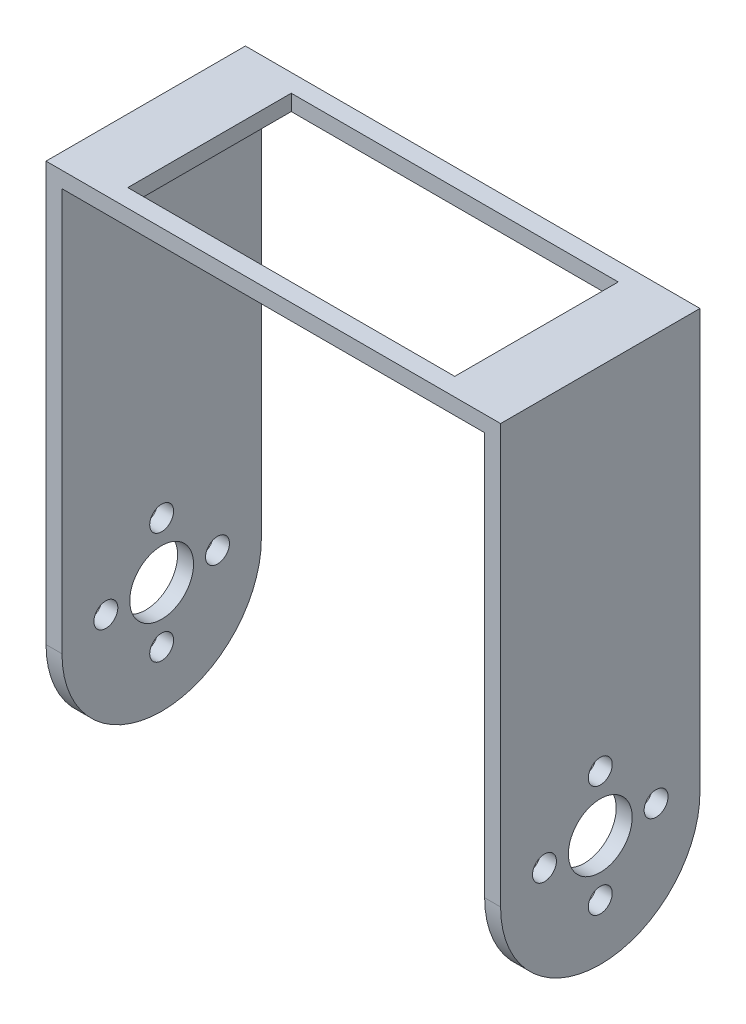
from build123d import *

# Parameters (mm, degrees)
BOSS_EXTRUDE2_DEPTH   = 25
SKETCH6_R             = 4
CUT_EXTRUDE2_DEPTH    = 78.032036302
CUT_EXTRUDE3_DEPTH    = 78.032036302
SKETCH9_R             = 1.5
CUT_EXTRUDE4_DEPTH    = 78.032036302
CROQUIS2_W            = 41
CROQUIS2_H            = 20.5
CORTAR_EXTRUIR1_DEPTH = 10


with BuildPart() as part:
    # Sketch3 → Boss-Extrude2 (new body)
    with BuildSketch(Plane.XY):
        Polygon((-79.925523148, 45.386502584), (-27.042967192, 45.386502584), (-24.925523148, 45.386502584), (-24.925523148, -19.613497416), (-26.925523148, -19.613497416), (-26.925523148, 43.389953837), (-79.925523148, 43.389953837), (-79.925523148, -19.613497416), (-81.925523148, -19.613497416), (-81.925523148, 45.386502584), align=None)
    extrude(amount=BOSS_EXTRUDE2_DEPTH)

    # Sketch6 → Cut-Extrude2 (cut, through all)
    with BuildSketch(Plane.ZY.offset(81.925523148)):
        with Locations(Location((12.5, -5.613497416, 0), (0, 0, 270))):
            Circle(SKETCH6_R)
    extrude(amount=-CUT_EXTRUDE2_DEPTH, mode=Mode.SUBTRACT)

    # Sketch8 → Cut-Extrude3 (cut, through all)
    with BuildSketch(Plane.ZY.offset(81.925523148)):
        with BuildLine():
            Line((0, -19.613497416), (12.5, -19.613497416))
            ThreePointArc((12.5, -19.613497416), (3.661165213, -15.952332159), (0, -7.113497352))
            Line((0, -7.113497352), (0, -19.613497416))
        make_face()
        with BuildLine():
            Line((12.5, -19.613497416), (25, -19.613497416))
            Line((25, -19.613497416), (25, -7.113497416))
            ThreePointArc((25, -7.113497416), (21.338834765, -15.952332181), (12.5, -19.613497416))
        make_face()
    extrude(amount=-CUT_EXTRUDE3_DEPTH, mode=Mode.SUBTRACT)

    # Sketch9 → Cut-Extrude4 (cut, through all)
    with BuildSketch(Plane(origin=(-24.925523148, 0, 0), x_dir=(0, 0, -1), z_dir=(1, 0, 0))):
        with Locations(Location((-12.500000994, 1.386498436, 0), (0, 0, 90))):
            Circle(SKETCH9_R)
        with Locations(Location((-5.500000994, -5.613501564, 0), (0, 0, 90))):
            Circle(SKETCH9_R)
        with Locations(Location((-12.500000994, -12.613501564, 0), (0, 0, 90))):
            Circle(SKETCH9_R)
        with Locations(Location((-19.500000994, -5.613501564, 0), (0, 0, 90))):
            Circle(SKETCH9_R)
    extrude(amount=-CUT_EXTRUDE4_DEPTH, mode=Mode.SUBTRACT)

    # Croquis2 → Cortar-Extruir1 (cut)
    with BuildSketch(Plane(origin=(0, 45.386502584, 0), x_dir=(1, 0, 0), z_dir=(0, 1, 0))):
        with Locations((-53.425523148, -12.5)):
            Rectangle(CROQUIS2_W, CROQUIS2_H)
    extrude(amount=-CORTAR_EXTRUIR1_DEPTH, mode=Mode.SUBTRACT)


solid = part.part
